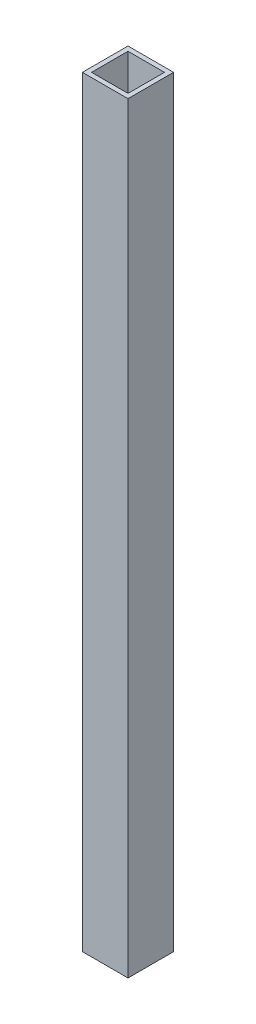
from build123d import *

# Parameters (mm, degrees)
SKETCH1_W           = 25.4
SKETCH1_H           = 25.4
SKETCH1_W_2         = 20.32
SKETCH1_H_2         = 20.32
BOSS_EXTRUDE1_DEPTH = 424.18


with BuildPart() as part:
    # Sketch1 → Boss-Extrude1 (new body)
    with BuildSketch(Plane(origin=(0, 0, 0), x_dir=(1, 0, 0), z_dir=(0, 1, 0))):
        Rectangle(SKETCH1_W, SKETCH1_H)
        Rectangle(SKETCH1_W_2, SKETCH1_H_2, mode=Mode.SUBTRACT)
    extrude(amount=BOSS_EXTRUDE1_DEPTH)


solid = part.part
